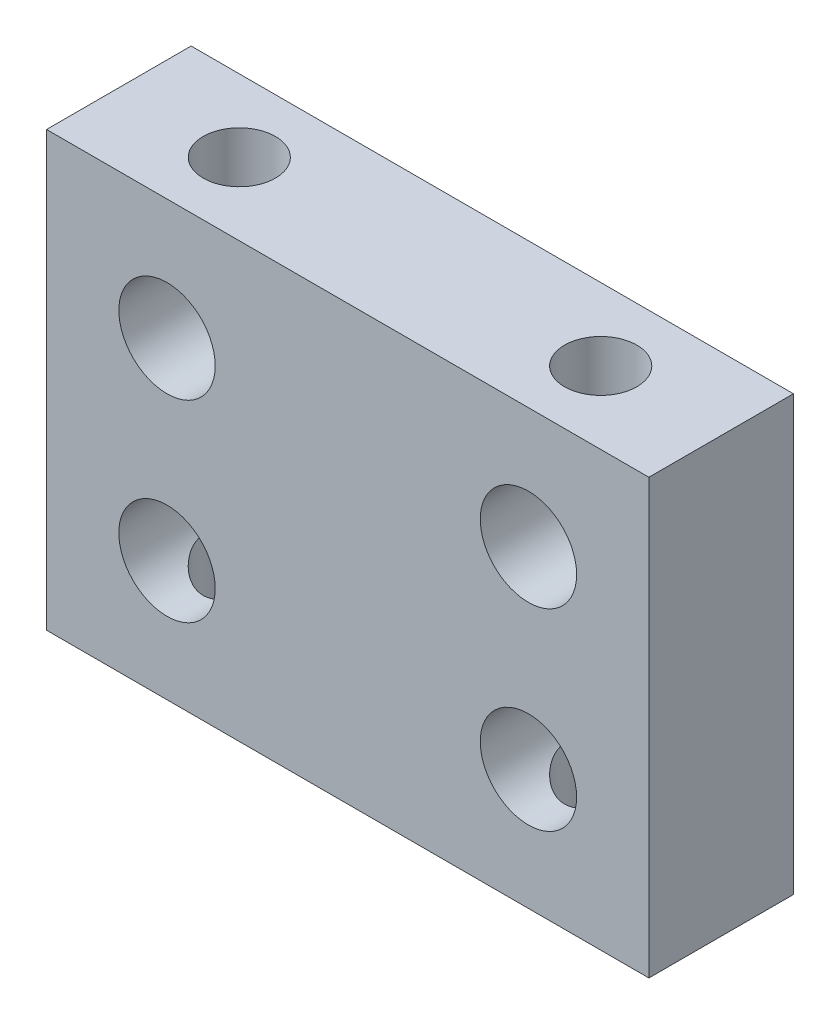
from build123d import *

# Parameters (mm, degrees)
SKETCH1_W           = 50
SKETCH1_H           = 36
SKETCH1_R           = 4
BOSS_EXTRUDE1_DEPTH = 12
CUT_EXTRUDE1_REACH  = 47.442
SKETCH2_R           = 3


with BuildPart() as part:
    # Sketch1 → Boss-Extrude1 (new body)
    with BuildSketch(Plane.XY):
        Rectangle(SKETCH1_W, SKETCH1_H)
        with Locations((-15, 8)):
            Circle(SKETCH1_R, mode=Mode.SUBTRACT)
        with Locations((-15, -8)):
            Circle(SKETCH1_R, mode=Mode.SUBTRACT)
        with Locations((15, -8)):
            Circle(SKETCH1_R, mode=Mode.SUBTRACT)
        with Locations((15, 8)):
            Circle(SKETCH1_R, mode=Mode.SUBTRACT)
    extrude(amount=BOSS_EXTRUDE1_DEPTH)

    # Sketch2 → Cut-Extrude1 (cut, up to next)
    with BuildSketch(Plane(origin=(0, 18, 0), x_dir=(1, 0, 0), z_dir=(0, 1, 0)), mode=Mode.PRIVATE) as cut_extrude1_sk1:
        with Locations(Location((-15, -6, 0), (0, 0, 270))):
            Circle(SKETCH2_R)
    cut_extrude1_tool1 = extrude(cut_extrude1_sk1.sketch, amount=-CUT_EXTRUDE1_REACH, mode=Mode.PRIVATE) & part.part
    # Sketch2 → Cut-Extrude1 (cut, up to next)
    with BuildSketch(Plane(origin=(0, 18, 0), x_dir=(1, 0, 0), z_dir=(0, 1, 0)), mode=Mode.PRIVATE) as cut_extrude1_sk2:
        with Locations(Location((15, -6, 0), (0, 0, 270))):
            Circle(SKETCH2_R)
    cut_extrude1_tool2 = extrude(cut_extrude1_sk2.sketch, amount=-CUT_EXTRUDE1_REACH, mode=Mode.PRIVATE) & part.part
    cut_extrude1_1 = cut_extrude1_tool1.solids().sort_by_distance((-15, 18, 6))[0]
    add(cut_extrude1_1, mode=Mode.SUBTRACT)
    cut_extrude1_2 = cut_extrude1_tool2.solids().sort_by_distance((15, 18, 6))[0]
    add(cut_extrude1_2, mode=Mode.SUBTRACT)
    cut_extrude1 = cut_extrude1_1 + cut_extrude1_2  # Cut-Extrude1 as one shape, for the pattern or mirror that repeats it

    # Mirror1: Cut-Extrude1 across plane
    add(cut_extrude1.mirror(Plane.ZX), mode=Mode.SUBTRACT)


solid = part.part
